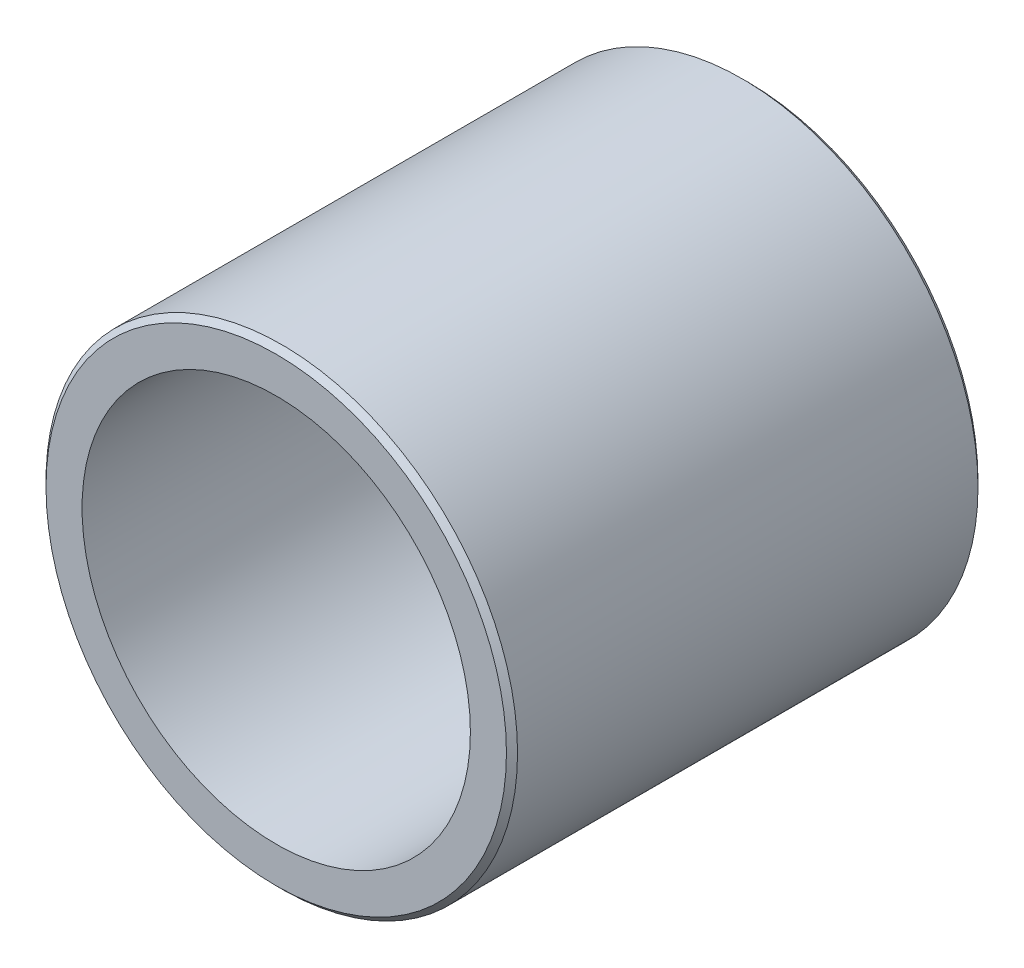
from build123d import *

# Parameters (mm, degrees)
SKETCH1_R           = 53.975
SKETCH1_R_2         = 44.45
BOSS_EXTRUDE1_DEPTH = 53.975
CHAMFER1_SIZE       = 1.27


with BuildPart() as part:
    # Sketch1 → Boss-Extrude1 (new, symmetric)
    with BuildSketch(Plane.XY):
        Circle(SKETCH1_R)
        Circle(SKETCH1_R_2, mode=Mode.SUBTRACT)
    extrude(amount=BOSS_EXTRUDE1_DEPTH, both=True)

    # Chamfer1
    chamfer1_edges = [part.edges().sort_by_distance(p)[0] for p in [
        (-53.975, 0, -53.975),
        (-53.975, 0, 53.975),
    ]]
    chamfer(chamfer1_edges, length=CHAMFER1_SIZE)


solid = part.part
